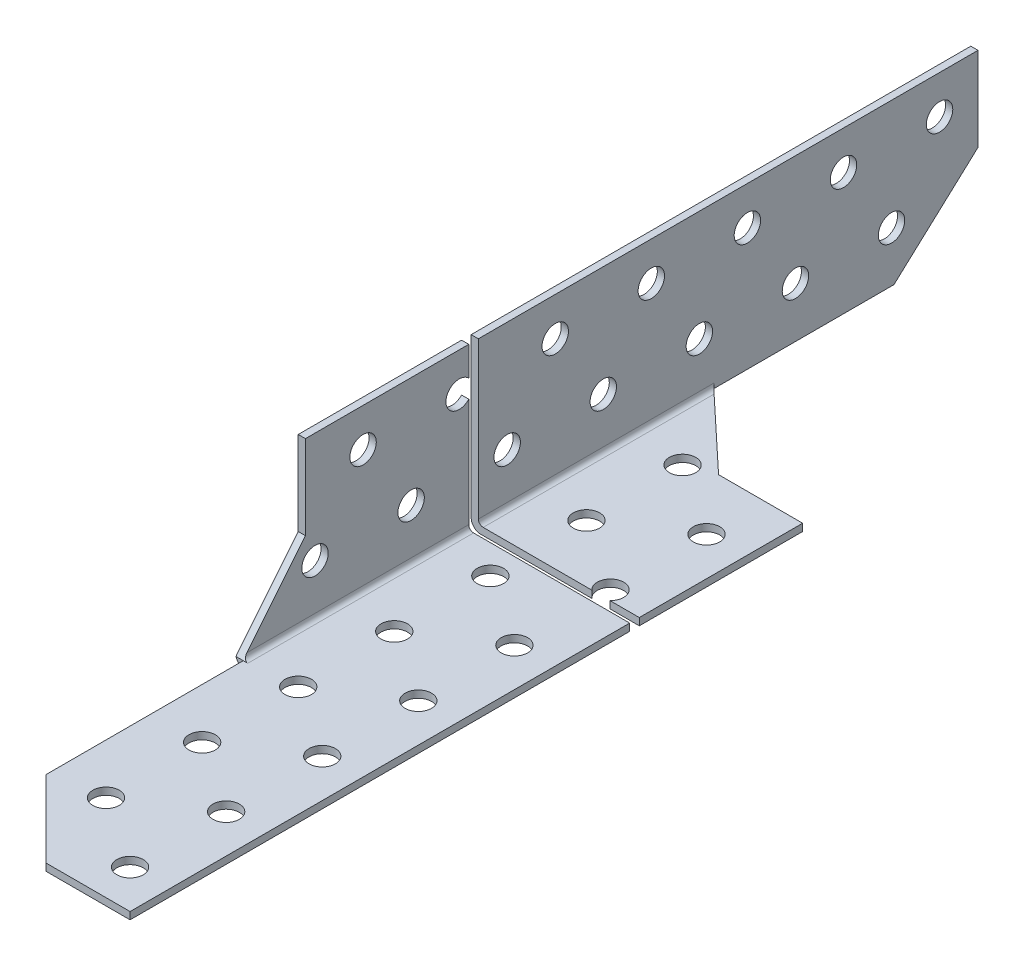
from build123d import *

# Parameters (mm, degrees)
SKETCH1_W               = 1.5
SKETCH1_H               = 33.5
SKETCH1_W_2             = 33.5
SKETCH1_H_2             = 1.5
BOSS_EXTRUDE1_DEPTH     = 210
CUT_EXTRUDE2_DEPTH      = 62
CUT_EXTRUDE2_DEPTH_BACK = 62
CUT_EXTRUDE3_DEPTH      = 62
SKETCH5_R               = 2.75
CUT_EXTRUDE4_DEPTH      = 5
FILLET1_R               = 1
FILLET2_R               = 2
SKETCH6_W               = 37.5
SKETCH6_H               = 1.436491673
CUT_EXTRUDE5_DEPTH      = 5
SKETCH7_W               = 1.5
SKETCH7_H               = 45.359757049
CUT_EXTRUDE6_DEPTH      = 5
SKETCH8_R               = 2.75
CUT_EXTRUDE7_DEPTH      = 5
CUT_EXTRUDE9_DEPTH      = 49
CUT_EXTRUDE9_DEPTH_BACK = 27
SKETCH10_W              = 49.176137077
SKETCH10_H              = 2


with BuildPart() as part:
    # Sketch1 → Boss-Extrude1 (new body)
    with BuildSketch(Plane.XY):
        with Locations((0, 0.75)):
            Rectangle(SKETCH1_W, SKETCH1_H)
        with Locations((17.5, -16.75)):
            Rectangle(SKETCH1_W_2, SKETCH1_H_2)
        with Locations((0, -16.75)):
            Rectangle(SKETCH1_W, SKETCH1_H_2)
    extrude(amount=BOSS_EXTRUDE1_DEPTH)

    # Sketch3 → Cut-Extrude2 (cut, two sides: drawn at the far end of the back side and taken through both)
    with BuildSketch(Plane(origin=(0.75, 0, 0), x_dir=(0, 0, -1), z_dir=(1, 0, 0)).offset(-CUT_EXTRUDE2_DEPTH_BACK)):
        Polygon((-140, 17.5), (-140, 0), (-153, -16), (-210, -16), (-210, 17.5), align=None)
        Polygon((0, 0), (-17.5, -16), (-17.5, -36.829348397), (0, -36.829348397), align=None)
    extrude(amount=CUT_EXTRUDE2_DEPTH + CUT_EXTRUDE2_DEPTH_BACK, mode=Mode.SUBTRACT)

    # Sketch4 → Cut-Extrude3 (cut)
    with BuildSketch(Plane(origin=(0, -16, 0), x_dir=(1, 0, 0), z_dir=(0, 1, 0))):
        Polygon((16.75, -210), (-0.75, -192.5), (-0.75, -210), align=None)
        Polygon((34.25, -70), (16.75, -70), (0.75, -55), (0.75, -17.5), (34.25, -17.5), align=None)
    extrude(amount=-CUT_EXTRUDE3_DEPTH, mode=Mode.SUBTRACT)

    # Sketch5 → Cut-Extrude4 (cut)
    with BuildSketch(Plane(origin=(0.75, 0, 0), x_dir=(0, 0, -1), z_dir=(1, 0, 0))):
        with Locations(Location((-8, 9.5, 0), (0, 0, 90))):
            Circle(SKETCH5_R)
        with Locations(Location((-28, 9.5, 0), (0, 0, 90))):
            Circle(SKETCH5_R)
        with Locations(Location((-48, 9.5, 0), (0, 0, 90))):
            Circle(SKETCH5_R)
        with Locations(Location((-68, 9.5, 0), (0, 0, 90))):
            Circle(SKETCH5_R)
        with Locations(Location((-88, 9.5, 0), (0, 0, 90))):
            Circle(SKETCH5_R)
        with Locations(Location((-108, 9.5, 0), (0, 0, 90))):
            Circle(SKETCH5_R)
        with Locations(Location((-128, 9.5, 0), (0, 0, 90))):
            Circle(SKETCH5_R)
        with Locations(Location((-18, -5.5, 0), (0, 0, 90))):
            Circle(SKETCH5_R)
        with Locations(Location((-38, -5.5, 0), (0, 0, 90))):
            Circle(SKETCH5_R)
        with Locations(Location((-58, -5.5, 0), (0, 0, 90))):
            Circle(SKETCH5_R)
        with Locations(Location((-78, -5.5, 0), (0, 0, 90))):
            Circle(SKETCH5_R)
        with Locations(Location((-98, -5.5, 0), (0, 0, 90))):
            Circle(SKETCH5_R)
        with Locations(Location((-118, -5.5, 0), (0, 0, 90))):
            Circle(SKETCH5_R)
        with Locations(Location((-138, -5.5, 0), (0, 0, 90))):
            Circle(SKETCH5_R)
    extrude(amount=-CUT_EXTRUDE4_DEPTH, mode=Mode.SUBTRACT)

    # Fillet1
    fillet1_edges = [part.edges().sort_by_distance(p)[0] for p in [
        (0.75, -16, 104),
    ]]
    fillet(fillet1_edges, radius=FILLET1_R)

    # Fillet2
    fillet2_edges = [part.edges().sort_by_distance(p)[0] for p in [
        (-0.75, -17.5, 105),
    ]]
    fillet(fillet2_edges, radius=FILLET2_R)

    # Sketch6 → Cut-Extrude5 (cut)
    with BuildSketch(Plane(origin=(0.75, 0, 0), x_dir=(0, 0, -1), z_dir=(1, 0, 0))):
        with Locations((-36.25, -16.718245837)):
            Rectangle(SKETCH6_W, SKETCH6_H)
    extrude(amount=-CUT_EXTRUDE5_DEPTH, mode=Mode.SUBTRACT)

    # Sketch7 → Cut-Extrude6 (cut)
    with BuildSketch(Plane(origin=(0, -16, 0), x_dir=(1, 0, 0), z_dir=(0, 1, 0))):
        with Locations((0.063508327, -175.679878524)):
            Rectangle(SKETCH7_W, SKETCH7_H)
    extrude(amount=-CUT_EXTRUDE6_DEPTH, mode=Mode.SUBTRACT)

    # Sketch8 → Cut-Extrude7 (cut)
    with BuildSketch(Plane(origin=(0, -16, 0), x_dir=(1, 0, 0), z_dir=(0, 1, 0))):
        with Locations(Location((11.25, -72, 0), (0, 0, 270))):
            Circle(SKETCH8_R)
        with Locations(Location((11.25, -92, 0), (0, 0, 270))):
            Circle(SKETCH8_R)
        with Locations(Location((11.25, -112, 0), (0, 0, 270))):
            Circle(SKETCH8_R)
        with Locations(Location((11.25, -132, 0), (0, 0, 270))):
            Circle(SKETCH8_R)
        with Locations(Location((11.25, -152, 0), (0, 0, 270))):
            Circle(SKETCH8_R)
        with Locations(Location((11.25, -172, 0), (0, 0, 270))):
            Circle(SKETCH8_R)
        with Locations(Location((11.25, -192, 0), (0, 0, 270))):
            Circle(SKETCH8_R)
        with Locations(Location((26.25, -82, 0), (0, 0, 270))):
            Circle(SKETCH8_R)
        with Locations(Location((26.25, -102, 0), (0, 0, 270))):
            Circle(SKETCH8_R)
        with Locations(Location((26.25, -122, 0), (0, 0, 270))):
            Circle(SKETCH8_R)
        with Locations(Location((26.25, -142, 0), (0, 0, 270))):
            Circle(SKETCH8_R)
        with Locations(Location((26.25, -162, 0), (0, 0, 270))):
            Circle(SKETCH8_R)
        with Locations(Location((26.25, -182, 0), (0, 0, 270))):
            Circle(SKETCH8_R)
        with Locations(Location((26.25, -202, 0), (0, 0, 270))):
            Circle(SKETCH8_R)
    extrude(amount=-CUT_EXTRUDE7_DEPTH, mode=Mode.SUBTRACT)

    # Sketch10 → Cut-Extrude9 (cut, two sides: drawn at the far end of the back side and taken through both)
    with BuildSketch(Plane(origin=(0, -16, 0), x_dir=(1, 0, 0), z_dir=(0, 1, 0)).offset(-CUT_EXTRUDE9_DEPTH_BACK)):
        with Locations((9.661931462, -105)):
            Rectangle(SKETCH10_W, SKETCH10_H)
    extrude(amount=CUT_EXTRUDE9_DEPTH + CUT_EXTRUDE9_DEPTH_BACK, mode=Mode.SUBTRACT)


with BuildPart() as cut_extrude9_piece_1:
    # of the separate pieces the step leaves, piece 1, a body of its own (cut_extrude9_pieces)
    add(part.part.solids().sort_by_distance((34.25, -16, 104))[0])


with BuildPart() as cut_extrude9_piece_2:
    # of the separate pieces the step leaves, piece 2, a body of its own (cut_extrude9_pieces)
    add(part.part.solids().sort_by_distance((-0.686491673, -16, 153))[0])


solid = Compound([cut_extrude9_piece_1.part, cut_extrude9_piece_2.part])
